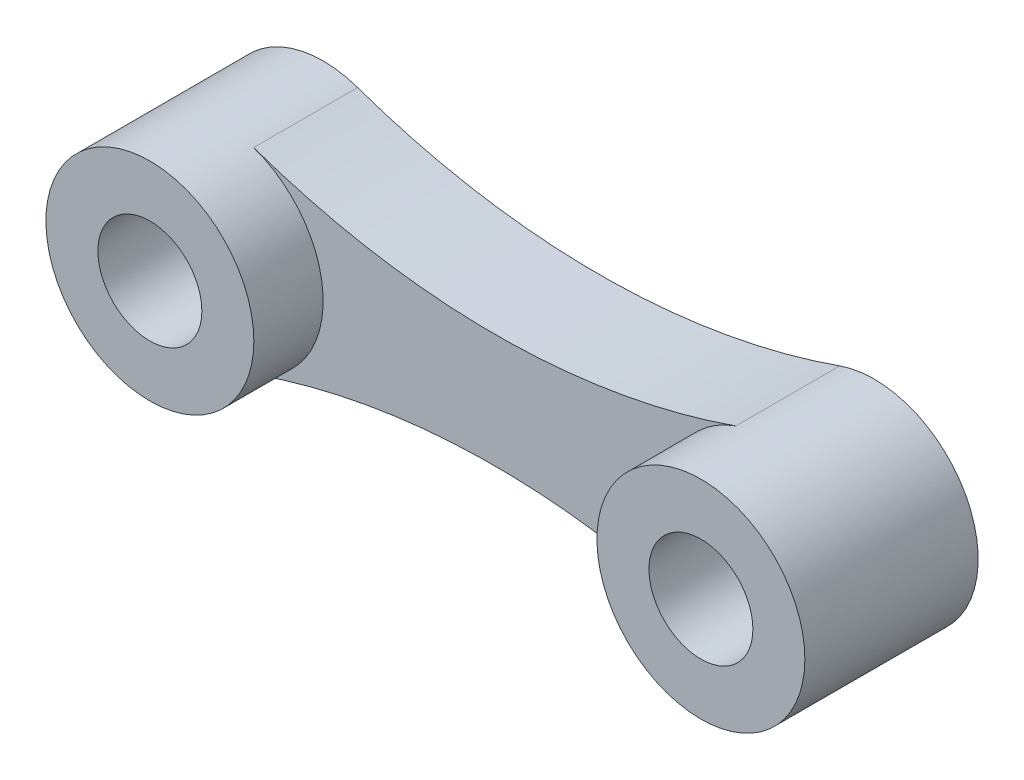
from build123d import *
from build123d.topology import SkipClean

# Parameters (mm, degrees)
SKETCH1_R           = 1.5
BOSS_EXTRUDE1_DEPTH = 1.5
SKETCH2_OUTSIDE_W   = 28.48
SKETCH2_OUTSIDE_H   = 12.58
CUT_EXTRUDE1_DEPTH  = 3
BOSS_EXTRUDE2_START = 2
SKETCH3_R           = 3
SKETCH3_R_2         = 1.5
BOSS_EXTRUDE2_DEPTH = 2


with BuildPart() as part:
    # Sketch1 → Boss-Extrude1 (new, symmetric)
    with BuildSketch(Plane.XY):
        with BuildLine():
            Line((-7.95, 3), (7.95, 3))
            ThreePointArc((7.95, 3), (10.95, 0), (7.95, -3))
            Line((7.95, -3), (-7.95, -3))
            ThreePointArc((-7.95, -3), (-10.95, 0), (-7.95, 3))
        make_face()
        with Locations((-7.95, 0)):
            Circle(SKETCH1_R, mode=Mode.SUBTRACT)
        with Locations((7.95, 0)):
            Circle(SKETCH1_R, mode=Mode.SUBTRACT)
    extrude(amount=BOSS_EXTRUDE1_DEPTH, both=True)

    # Sketch2 outside → Cut-Extrude1 (cut)
    with SkipClean():  # the faces are left unmerged after this step: merging them gives an invalid solid
        with BuildSketch(Plane.XY.offset(1.5)):
            Rectangle(SKETCH2_OUTSIDE_W, SKETCH2_OUTSIDE_H)
            with BuildLine():
                ThreePointArc((-6.95625, 2.830629071), (-10.95, 0), (-6.95625, -2.830629071))
                ThreePointArc((-6.95625, -2.830629071), (0, -1.645032568), (6.95625, -2.830629071))
                ThreePointArc((6.95625, -2.830629071), (10.95, 0), (6.95625, 2.830629071))
                ThreePointArc((6.95625, 2.830629071), (0, 1.645032568), (-6.95625, 2.830629071))
            make_face(mode=Mode.SUBTRACT)
        extrude(amount=-CUT_EXTRUDE1_DEPTH, mode=Mode.SUBTRACT)

    # Sketch3 → Boss-Extrude2 (add)
    # profile 1 of 2: a face of its own
    with SkipClean():  # the faces are left unmerged after this step: merging them gives an invalid solid
        with BuildSketch(Plane.XY.offset(1.5).offset(BOSS_EXTRUDE2_START)):
            with Locations(Location((-7.95, 0, 0), (0, 0, 289.344662967))):
                Circle(SKETCH3_R)
            with Locations((-7.95, 0)):
                Circle(SKETCH3_R_2, mode=Mode.SUBTRACT)
        # profile 2 of 2: a face of its own
        with BuildSketch(Plane.XY.offset(1.5).offset(BOSS_EXTRUDE2_START)):
            with Locations(Location((7.95, 0, 0), (0, 0, 250.655337033))):
                Circle(SKETCH3_R)
            with Locations((7.95, 0)):
                Circle(SKETCH3_R_2, mode=Mode.SUBTRACT)
        extrude(amount=-BOSS_EXTRUDE2_DEPTH)


solid = part.part
